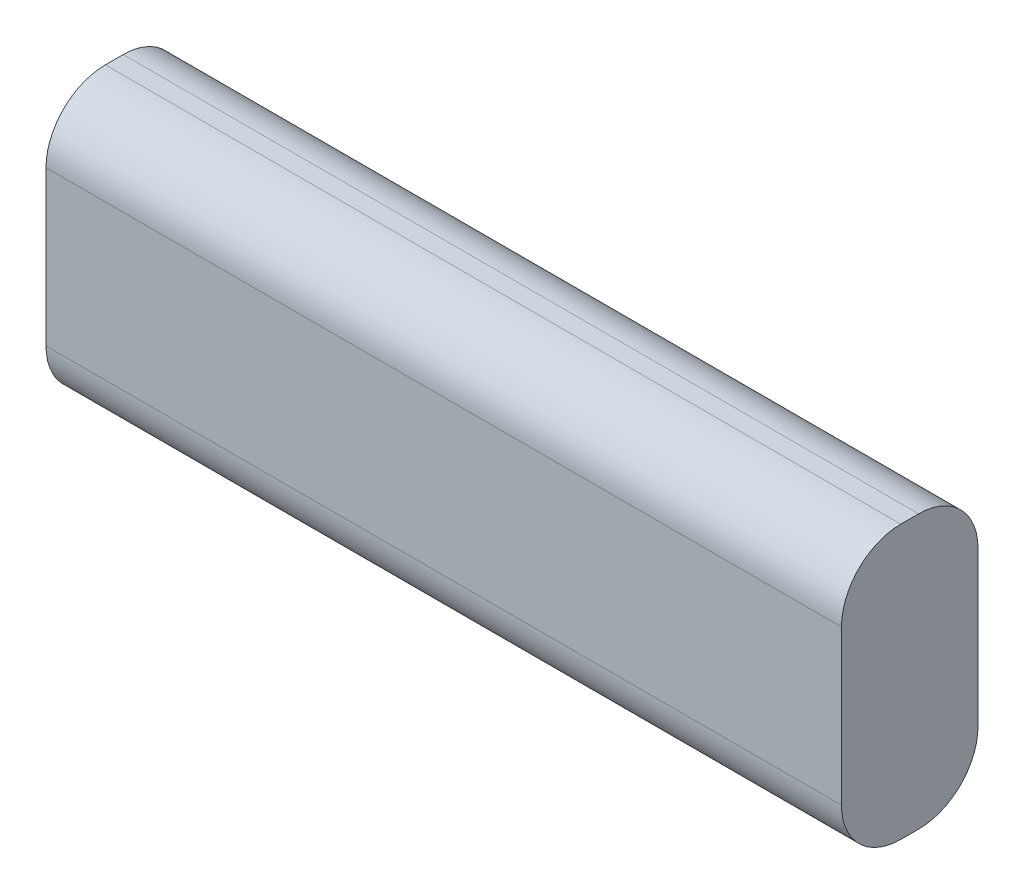
from build123d import *

# Parameters (mm, degrees)
SKETCH1_W           = 134
SKETCH1_H           = 46
BOSS_EXTRUDE1_DEPTH = 23
FILLET4_R           = 10


with BuildPart() as part:
    # Sketch1 → Boss-Extrude1 (new body)
    with BuildSketch(Plane.XY):
        with Locations((67, 23)):
            Rectangle(SKETCH1_W, SKETCH1_H)
    extrude(amount=BOSS_EXTRUDE1_DEPTH)

    # Fillet4
    fillet4_edges = [part.edges().sort_by_distance(p)[0] for p in [
        (67, 46, 23),
        (67, 46, 0),
        (67, 0, 0),
        (67, 0, 23),
    ]]
    fillet(fillet4_edges, radius=FILLET4_R)


solid = part.part
